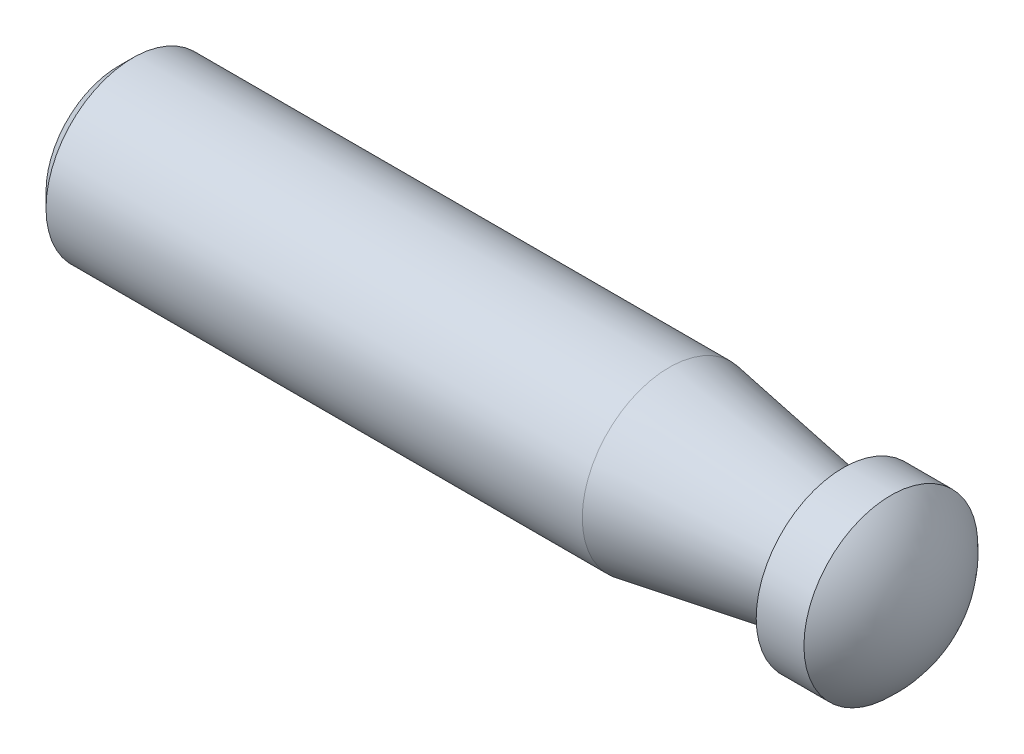
from build123d import *

# Parameters (mm, degrees)
CHANFREIN1_SIZE = 0.5


with BuildPart() as part:
    # Esquisse1 → Base-Révolution (revolve)
    with BuildSketch(Plane.XY, mode=Mode.PRIVATE) as base_r_volution_sk:
        with BuildLine():
            Line((0, 0), (0, 3))
            Line((0, 3), (19, 3))
            Line((19, 3), (25, 2))
            Line((25, 2), (25, 3))
            Line((25, 3), (26.645751311, 3))
            ThreePointArc((26.645751311, 3), (27.645751311, 1.645751311), (28, 0))
            Line((28, 0), (0, 0))
        make_face()
    revolve(base_r_volution_sk.sketch.rotate(Axis((0, 0, 0), (1, 0, 0)), 90), axis=Axis((0, 0, 0), (1, 0, 0)))

    # Chanfrein1
    chanfrein1_edges = [part.edges().sort_by_distance(p)[0] for p in [
        (0, 0, -3),
    ]]
    chamfer(chanfrein1_edges, length=CHANFREIN1_SIZE)


solid = part.part
